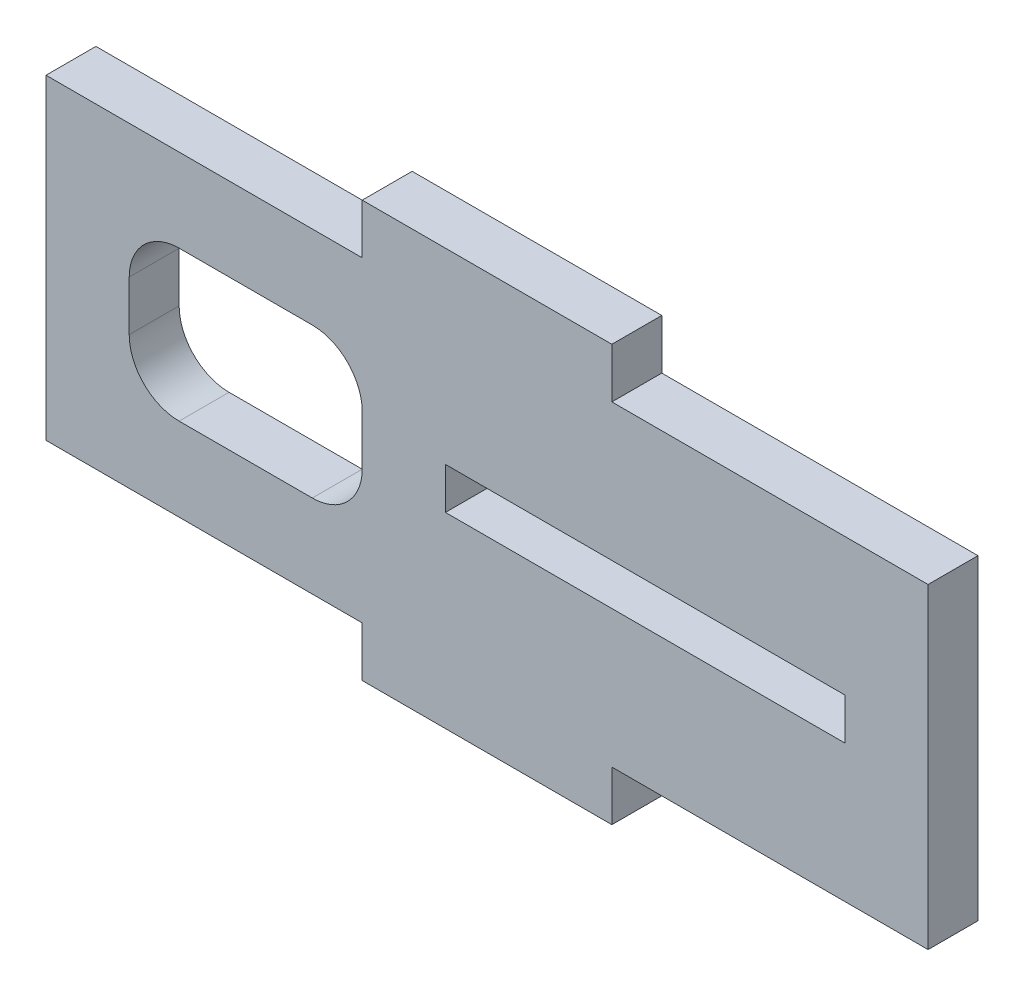
from build123d import *

# Parameters (mm, degrees)
SKETCH1_W           = 24
SKETCH1_H           = 2.5
BOSS_EXTRUDE1_DEPTH = 3


with BuildPart() as part:
    # Sketch1 → Boss-Extrude1 (new body)
    with BuildSketch(Plane.XY):
        Polygon((-26.5, -9.5), (-26.5, 9.5), (-7.5, 9.5), (-7.5, 12.5), (7.5, 12.5), (7.5, 9.5), (26.5, 9.5), (26.5, -9.5), (7.5, -9.5), (7.5, -12.5), (-7.5, -12.5), (-7.5, -9.5), align=None)
        with Locations((9.5, 0)):
            Rectangle(SKETCH1_W, SKETCH1_H, mode=Mode.SUBTRACT)
        with BuildLine():
            Line((-18.5, 4.5), (-10.5, 4.5))
            ThreePointArc((-10.5, 4.5), (-8.378679656, 3.621320344), (-7.5, 1.5))
            Line((-7.5, 1.5), (-7.5, -1.5))
            ThreePointArc((-7.5, -1.5), (-8.378679656, -3.621320344), (-10.5, -4.5))
            Line((-10.5, -4.5), (-18.5, -4.5))
            ThreePointArc((-18.5, -4.5), (-20.621320344, -3.621320344), (-21.5, -1.5))
            Line((-21.5, -1.5), (-21.5, 1.5))
            ThreePointArc((-21.5, 1.5), (-20.621320344, 3.621320344), (-18.5, 4.5))
        make_face(mode=Mode.SUBTRACT)
    extrude(amount=BOSS_EXTRUDE1_DEPTH)


solid = part.part
